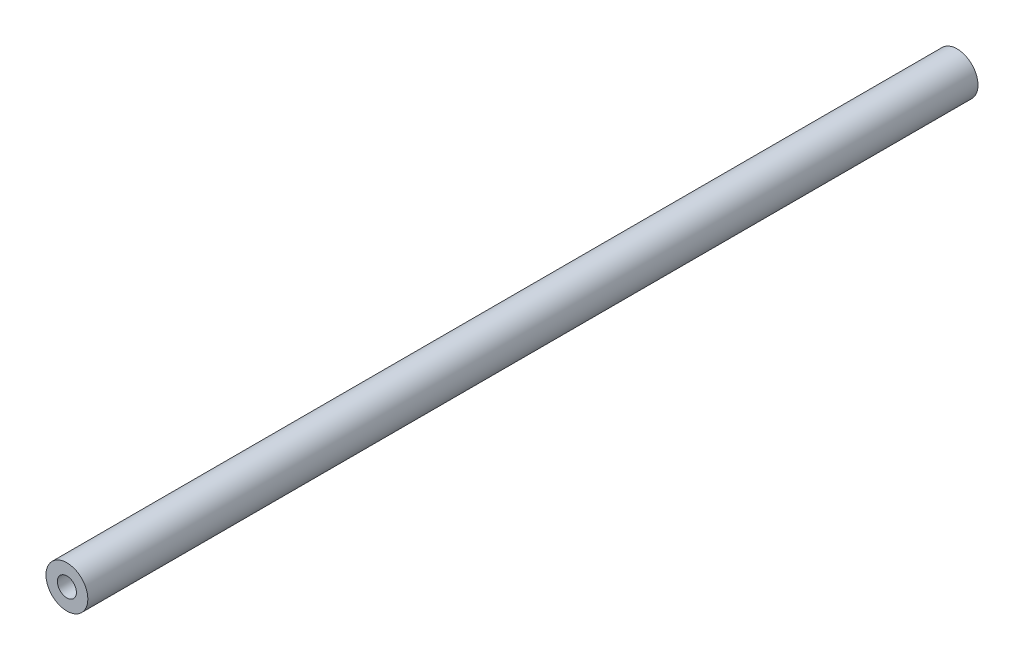
from build123d import *

# Parameters (mm, degrees)
SKETCH1_R           = 2.75
SKETCH1_R_2         = 1.25
BOSS_EXTRUDE1_DEPTH = 116.92


with BuildPart() as part:
    # Sketch1 → Boss-Extrude1 (new body)
    with BuildSketch(Plane.XY):
        Circle(SKETCH1_R)
        Circle(SKETCH1_R_2, mode=Mode.SUBTRACT)
    extrude(amount=BOSS_EXTRUDE1_DEPTH)


solid = part.part
